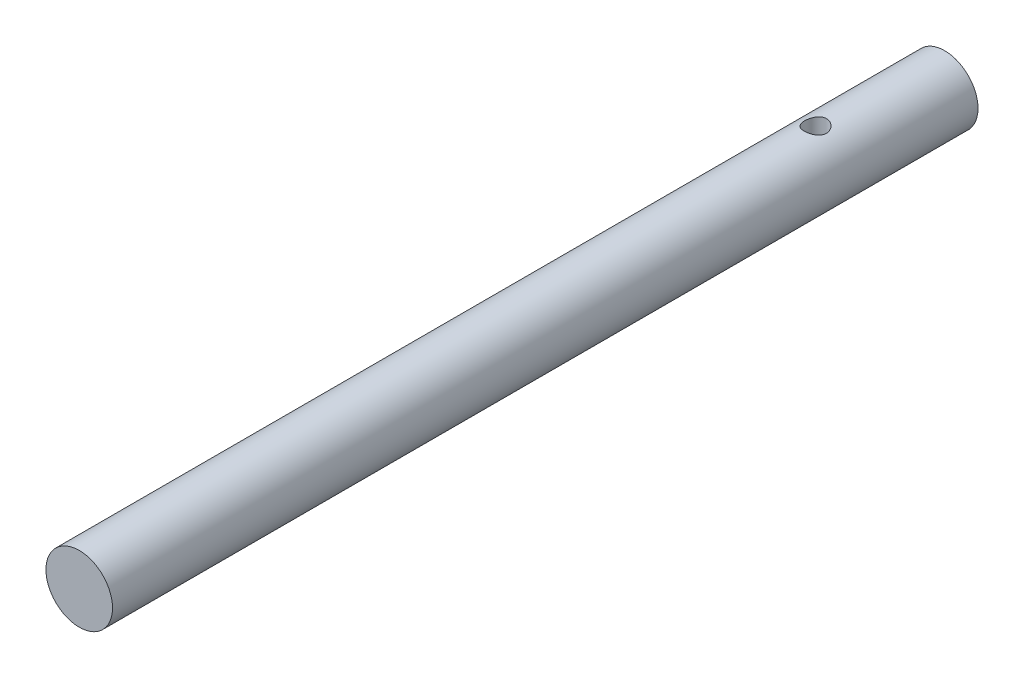
from build123d import *

# Parameters (mm, degrees)
SKETCH1_R                 = 5
BOSS_EXTRUDE1_DEPTH       = 130
M4X0_7_TAPPED_HOLE1_D     = 3.3
M4X0_7_TAPPED_HOLE1_DEPTH = 4
M4X0_7_TAPPED_HOLE1_TIP   = 0.991420021


with BuildPart() as part:
    # Sketch1 → Boss-Extrude1 (new body)
    with BuildSketch(Plane.XY):
        Circle(SKETCH1_R)
    extrude(amount=BOSS_EXTRUDE1_DEPTH)

    # M4x0.7 Tapped Hole1
    with Locations(Plane(origin=(-0.050045775, 4.999749536, 19.364916731), x_dir=(0.999949907154, 0.010009154936, 0), z_dir=(-0.010009154936, 0.999949907154, 0))):
        with Locations((0, 0)):
            Hole(M4X0_7_TAPPED_HOLE1_D / 2, depth=M4X0_7_TAPPED_HOLE1_DEPTH)
            with Locations((0, 0, -(M4X0_7_TAPPED_HOLE1_DEPTH + M4X0_7_TAPPED_HOLE1_TIP / 2))):  # 118° drill point
                Cone(0, M4X0_7_TAPPED_HOLE1_D / 2, M4X0_7_TAPPED_HOLE1_TIP, mode=Mode.SUBTRACT)


solid = part.part
